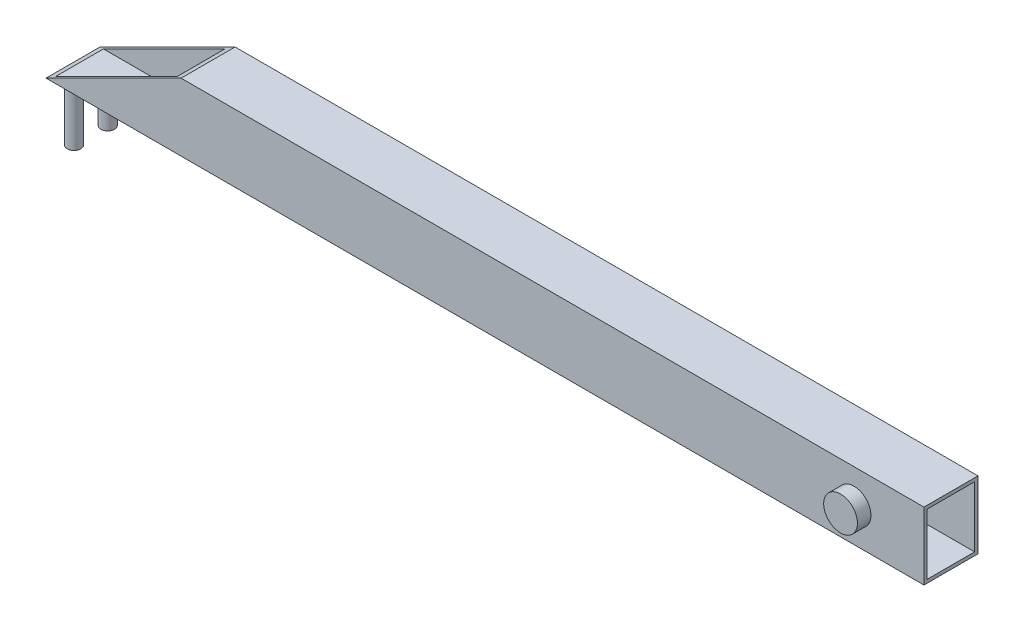
from build123d import *

# Parameters (mm, degrees)
ESQUISSE1_R             = 2.5
BOSS_EXTRU_1_DEPTH      = 8
ESQUISSE2_W             = 7.087737969
ESQUISSE2_H             = 9
ENL_V_MAT_EXTRU_1_DEPTH = 600
ESQUISSE3_R             = 2.5
BOSS_EXTRU_2_DEPTH      = 2
ESQUISSE4_R             = 1
BOSS_EXTRU_3_DEPTH      = 8


with BuildPart() as part:
    # Esquisse1 → Boss.-Extru.1 (new body)
    with BuildSketch(Plane.XY):
        Polygon((10.350579175, 0), (10.350579175, 5), (-99.649420825, 5), (-119.649420825, -5), (10.350579175, -5), align=None)
        Circle(ESQUISSE1_R, mode=Mode.SUBTRACT)
    extrude(amount=BOSS_EXTRU_1_DEPTH)

    # Esquisse2 → Enlèv. mat.-Extru.1 (cut)
    with BuildSketch(Plane(origin=(10.350579175, 0, 0), x_dir=(0, 0, -1), z_dir=(1, 0, 0))):
        with Locations((-4.043868985, 0)):
            Rectangle(ESQUISSE2_W, ESQUISSE2_H)
    extrude(amount=-ENL_V_MAT_EXTRU_1_DEPTH, mode=Mode.SUBTRACT)

    # Esquisse4 → Boss.-Extru.3 (add)
    with BuildSketch(Plane.XZ.offset(5)):
        with Locations(Location((-117.007626081, 6.5, 0), (0, 0, 180))):
            Circle(ESQUISSE4_R)
        with Locations(Location((-117.007626081, 1.5, 0), (0, 0, 180))):
            Circle(ESQUISSE4_R)
    extrude(amount=BOSS_EXTRU_3_DEPTH)


with BuildPart() as body_2:
    # Esquisse3 → Boss.-Extru.2 (new body)
    with BuildSketch(Plane.XY.offset(8)):
        Circle(ESQUISSE3_R)
    extrude(amount=BOSS_EXTRU_2_DEPTH)


solid = Compound([part.part, body_2.part])
